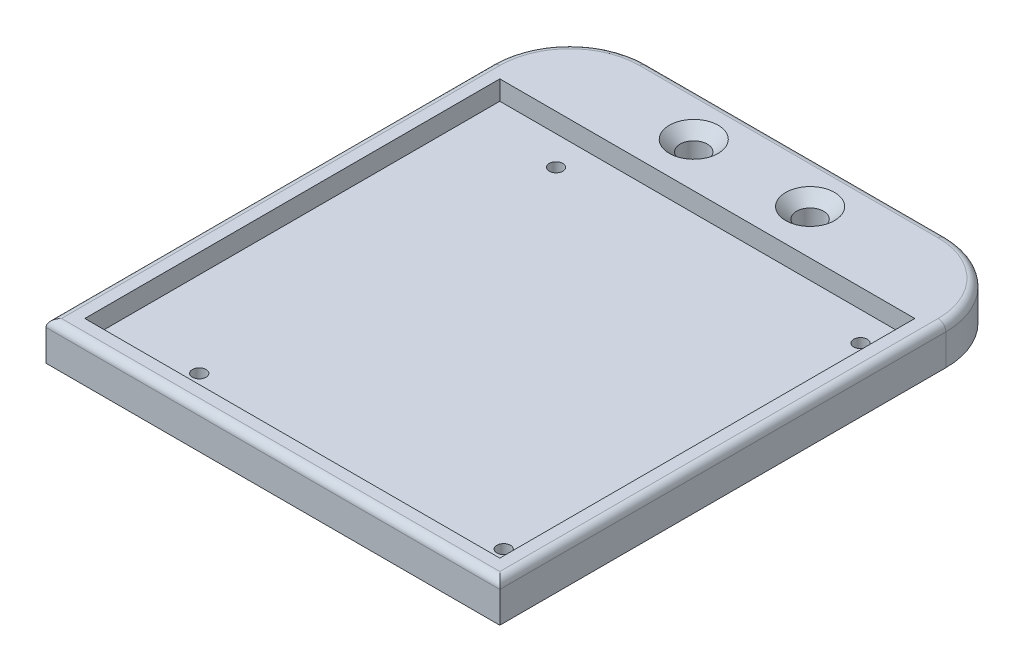
from build123d import *

# Parameters (mm, degrees)
SKETCH2_W                                       = 117
SKETCH2_H                                       = 135
BOSS_EXTRUDE1_DEPTH                             = 10
SKETCH4_W                                       = 107
SKETCH4_H                                       = 107
CUT_EXTRUDE1_DEPTH                              = 5
SKETCH3_R                                       = 1.75
CUT_EXTRUDE2_DEPTH                              = 90.462282555
CSK_FOR_M6_FLAT_HEAD_MACHINE_SCREW1_D           = 7
CSK_FOR_M6_FLAT_HEAD_MACHINE_SCREW1_CSINK_D     = 12.6
CSK_FOR_M6_FLAT_HEAD_MACHINE_SCREW1_CSINK_ANGLE = 90
FILLET1_R                                       = 20
FILLET2_R                                       = 2


with BuildPart() as part:
    # Sketch2 → Boss-Extrude1 (new body)
    with BuildSketch(Plane(origin=(0, 0, 0), x_dir=(1, 0, 0), z_dir=(0, 1, 0))):
        Rectangle(SKETCH2_W, SKETCH2_H)
    extrude(amount=BOSS_EXTRUDE1_DEPTH)

    # Sketch4 → Cut-Extrude1 (cut)
    with BuildSketch(Plane(origin=(0, 10, 0), x_dir=(1, 0, 0), z_dir=(0, 1, 0))):
        with Locations((0, -9)):
            Rectangle(SKETCH4_W, SKETCH4_H)
    extrude(amount=-CUT_EXTRUDE1_DEPTH, mode=Mode.SUBTRACT)

    # Sketch3 → Cut-Extrude2 (cut, through all)
    with BuildSketch(Plane(origin=(0, 5, 0), x_dir=(1, 0, 0), z_dir=(0, 1, 0))):
        with Locations(Location((-31.5, 37, 0), (0, 0, 270))):
            Circle(SKETCH3_R)
        with Locations(Location((47, 37, 0), (0, 0, 270))):
            Circle(SKETCH3_R)
        with Locations(Location((47, -55, 0), (0, 0, 270))):
            Circle(SKETCH3_R)
        with Locations(Location((-31.5, -55, 0), (0, 0, 270))):
            Circle(SKETCH3_R)
    extrude(amount=-CUT_EXTRUDE2_DEPTH, mode=Mode.SUBTRACT)

    # CSK for M6 Flat Head Machine Screw1 (through all)
    with Locations(Plane(origin=(0, 10, 0), x_dir=(1, 0, 0), z_dir=(0, 1, 0))):
        with Locations((-15, 56), (15, 56)):
            CounterSinkHole(CSK_FOR_M6_FLAT_HEAD_MACHINE_SCREW1_D / 2, CSK_FOR_M6_FLAT_HEAD_MACHINE_SCREW1_CSINK_D / 2, counter_sink_angle=CSK_FOR_M6_FLAT_HEAD_MACHINE_SCREW1_CSINK_ANGLE)

    # Fillet1
    fillet1_edges = [part.edges().sort_by_distance(p)[0] for p in [
        (-58.5, 5, -67.5),
        (58.5, 5, -67.5),
    ]]
    fillet(fillet1_edges, radius=FILLET1_R)

    # Fillet2
    fillet2_edges = [part.edges().sort_by_distance(p)[0] for p in [
        (0, 10, 67.5),
        (58.5, 10, 10),
        (0, 10, -67.5),
        (-58.5, 10, 10),
        (-52.642135624, 10, -61.642135624),
        (52.642135624, 10, -61.642135624),
    ]]
    fillet(fillet2_edges, radius=FILLET2_R)


solid = part.part
